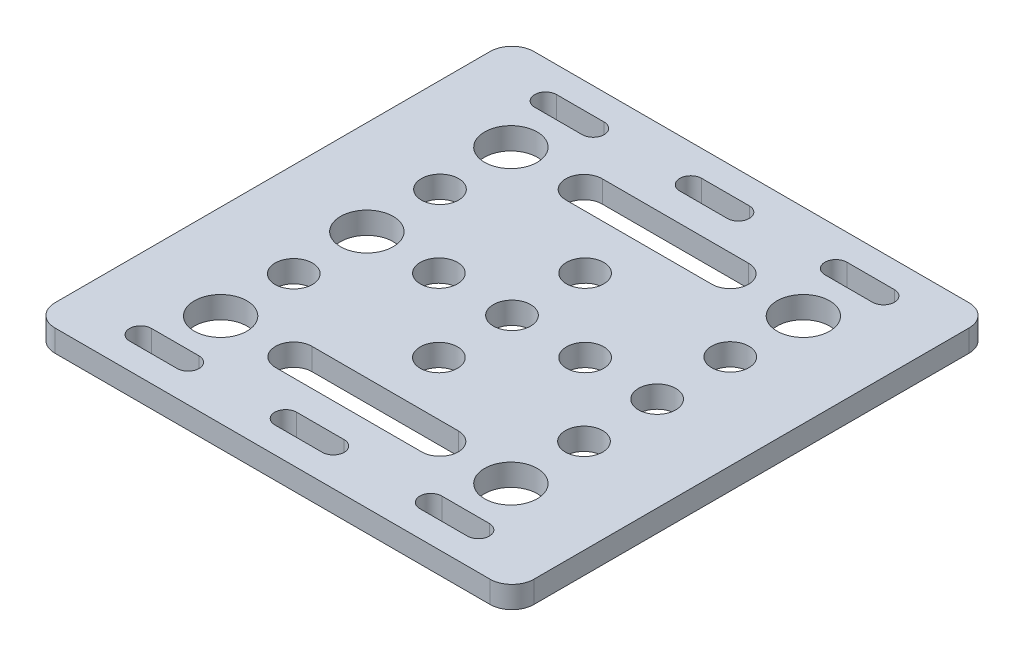
from build123d import *

# Parameters (mm, degrees)
SKETCH1_R           = 3.6
SKETCH1_R_2         = 2.55
BOSS_EXTRUDE1_DEPTH = 3


with BuildPart() as part:
    # Sketch1 → Boss-Extrude1 (new body)
    with BuildSketch(Plane(origin=(0, 0, 0), x_dir=(1, 0, 0), z_dir=(0, 1, 0))):
        with BuildLine():
            Line((-29.75, 32.75), (29.75, 32.75))
            ThreePointArc((29.75, 32.75), (31.871320344, 31.871320344), (32.75, 29.75))
            Line((32.75, 29.75), (32.75, -29.75))
            ThreePointArc((32.75, -29.75), (31.871320344, -31.871320344), (29.75, -32.75))
            Line((29.75, -32.75), (-29.75, -32.75))
            ThreePointArc((-29.75, -32.75), (-31.871320344, -31.871320344), (-32.75, -29.75))
            Line((-32.75, -29.75), (-32.75, 29.75))
            ThreePointArc((-32.75, 29.75), (-31.871320344, 31.871320344), (-29.75, 32.75))
        make_face()
        with Locations(Location((-20, 19.85, 0), (0, 0, 270))):
            Circle(SKETCH1_R, mode=Mode.SUBTRACT)
        with Locations(Location((-19.85, 0, 0), (0, 0, 270))):
            Circle(SKETCH1_R, mode=Mode.SUBTRACT)
        with Locations(Location((-19.85, -20, 0), (0, 0, 270))):
            Circle(SKETCH1_R, mode=Mode.SUBTRACT)
        with Locations(Location((-19.85, 10, 0), (0, 0, 270))):
            Circle(SKETCH1_R_2, mode=Mode.SUBTRACT)
        with Locations(Location((-19.85, -10, 0), (0, 0, 90))):
            Circle(SKETCH1_R_2, mode=Mode.SUBTRACT)
        with Locations(Location((19.85, -20, 0), (0, 0, 90))):
            Circle(SKETCH1_R, mode=Mode.SUBTRACT)
        with Locations(Location((20, 19.85, 0), (0, 0, 90))):
            Circle(SKETCH1_R, mode=Mode.SUBTRACT)
        with Locations(Location((19.85, 10, 0), (0, 0, 90))):
            Circle(SKETCH1_R_2, mode=Mode.SUBTRACT)
        with Locations(Location((19.85, -10, 0), (0, 0, 270))):
            Circle(SKETCH1_R_2, mode=Mode.SUBTRACT)
        with Locations(Location((19.85, 0, 0), (0, 0, 270))):
            Circle(SKETCH1_R_2, mode=Mode.SUBTRACT)
        with Locations(Location((0, 0, 0), (0, 0, 270))):
            Circle(SKETCH1_R_2, mode=Mode.SUBTRACT)
        with Locations(Location((10, 0, 0), (0, 0, 270))):
            Circle(SKETCH1_R_2, mode=Mode.SUBTRACT)
        with Locations(Location((0, 10, 0), (0, 0, 90))):
            Circle(SKETCH1_R_2, mode=Mode.SUBTRACT)
        with Locations(Location((-10, 0, 0), (0, 0, 270))):
            Circle(SKETCH1_R_2, mode=Mode.SUBTRACT)
        with Locations(Location((0, -10, 0), (0, 0, 90))):
            Circle(SKETCH1_R_2, mode=Mode.SUBTRACT)
        with BuildLine():
            Line((-3.25, 29.2), (3.25, 29.2))
            ThreePointArc((3.25, 29.2), (4.75, 27.7), (3.25, 26.2))
            Line((3.25, 26.2), (-3.25, 26.2))
            ThreePointArc((-3.25, 26.2), (-4.75, 27.7), (-3.25, 29.2))
        make_face(mode=Mode.SUBTRACT)
        with BuildLine():
            Line((16.6, 29.2), (23.1, 29.2))
            ThreePointArc((23.1, 29.2), (24.6, 27.7), (23.1, 26.2))
            Line((23.1, 26.2), (16.6, 26.2))
            ThreePointArc((16.6, 26.2), (15.1, 27.7), (16.6, 29.2))
        make_face(mode=Mode.SUBTRACT)
        with BuildLine():
            Line((-16.6, 26.2), (-23.1, 26.2))
            ThreePointArc((-23.1, 26.2), (-24.6, 27.7), (-23.1, 29.2))
            Line((-23.1, 29.2), (-16.6, 29.2))
            ThreePointArc((-16.6, 29.2), (-15.1, 27.7), (-16.6, 26.2))
        make_face(mode=Mode.SUBTRACT)
        with BuildLine():
            Line((-16.6, -29.2), (-23.1, -29.2))
            ThreePointArc((-23.1, -29.2), (-24.6, -27.7), (-23.1, -26.2))
            Line((-23.1, -26.2), (-16.6, -26.2))
            ThreePointArc((-16.6, -26.2), (-15.1, -27.7), (-16.6, -29.2))
        make_face(mode=Mode.SUBTRACT)
        with BuildLine():
            Line((16.6, -26.2), (23.1, -26.2))
            ThreePointArc((23.1, -26.2), (24.6, -27.7), (23.1, -29.2))
            Line((23.1, -29.2), (16.6, -29.2))
            ThreePointArc((16.6, -29.2), (15.1, -27.7), (16.6, -26.2))
        make_face(mode=Mode.SUBTRACT)
        with BuildLine():
            Line((-3.25, -26.2), (3.25, -26.2))
            ThreePointArc((3.25, -26.2), (4.75, -27.7), (3.25, -29.2))
            Line((3.25, -29.2), (-3.25, -29.2))
            ThreePointArc((-3.25, -29.2), (-4.75, -27.7), (-3.25, -26.2))
        make_face(mode=Mode.SUBTRACT)
        with BuildLine():
            Line((-10, -17.35), (10, -17.35))
            ThreePointArc((10, -17.35), (12.5, -19.85), (10, -22.35))
            Line((10, -22.35), (-10, -22.35))
            ThreePointArc((-10, -22.35), (-12.5, -19.85), (-10, -17.35))
        make_face(mode=Mode.SUBTRACT)
        with BuildLine():
            Line((-10, 22.35), (10, 22.35))
            ThreePointArc((10, 22.35), (12.5, 19.85), (10, 17.35))
            Line((10, 17.35), (-10, 17.35))
            ThreePointArc((-10, 17.35), (-12.5, 19.85), (-10, 22.35))
        make_face(mode=Mode.SUBTRACT)
    extrude(amount=BOSS_EXTRUDE1_DEPTH)


solid = part.part
